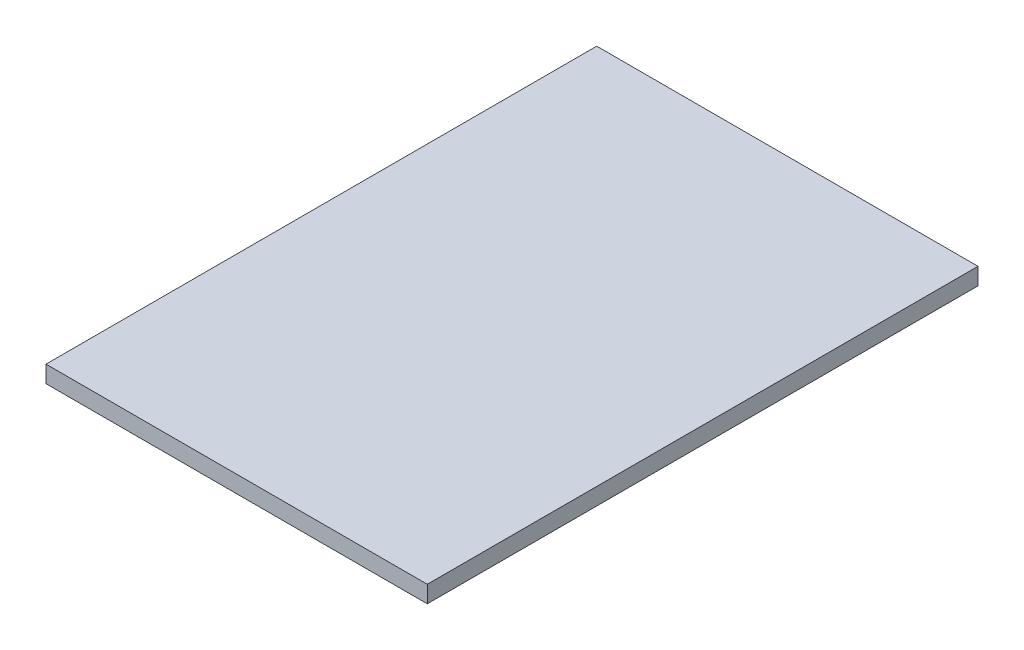
from build123d import *

# Parameters (mm, degrees)
SKETCH1_W           = 450
SKETCH1_H           = 650
BOSS_EXTRUDE1_DEPTH = 10


with BuildPart() as part:
    # Sketch1 → Boss-Extrude1 (new, symmetric)
    with BuildSketch(Plane(origin=(0, 0, 0), x_dir=(1, 0, 0), z_dir=(0, 1, 0))):
        Rectangle(SKETCH1_W, SKETCH1_H)
    extrude(amount=BOSS_EXTRUDE1_DEPTH, both=True)


solid = part.part
